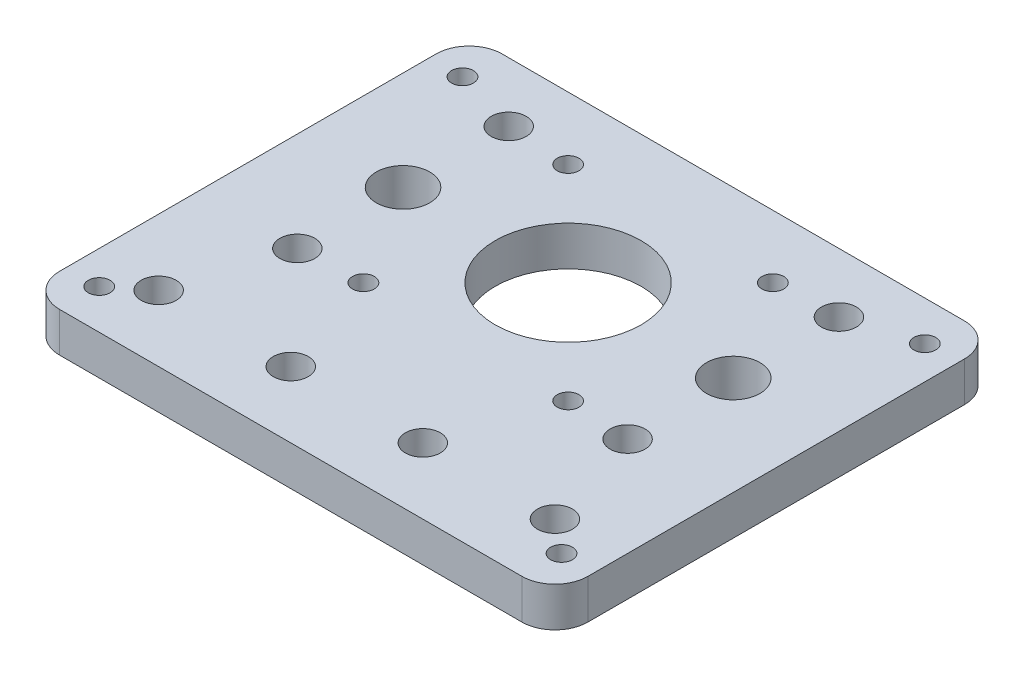
from build123d import *

# Parameters (mm, degrees)
SKETCH_1_R      = 11.05
SKETCH_1_R_2    = 1.65
SKETCH_1_R_3    = 4.05
SKETCH_1_R_4    = 2.65
EXTRUDE_1_DEPTH = 6


with BuildPart() as part:
    # 草图1 → 凸台-拉伸1 (new body)
    with BuildSketch(Plane(origin=(0, 0, 0), x_dir=(1, 0, 0), z_dir=(0, 1, 0))):
        with BuildLine():
            Line((-35, -42), (35, -42))
            ThreePointArc((35, -42), (38.535533906, -40.535533906), (40, -37))
            Line((40, -37), (40, 20))
            ThreePointArc((40, 20), (38.535533906, 23.535533906), (35, 25))
            Line((35, 25), (-35, 25))
            ThreePointArc((-35, 25), (-38.535533906, 23.535533906), (-40, 20))
            Line((-40, 20), (-40, -37))
            ThreePointArc((-40, -37), (-38.535533906, -40.535533906), (-35, -42))
        make_face()
        with Locations(Location((0, 0, 0), (0, 0, 270))):
            Circle(SKETCH_1_R, mode=Mode.SUBTRACT)
        with Locations(Location((-15.5, 15.5, 0), (0, 0, 270))):
            Circle(SKETCH_1_R_2, mode=Mode.SUBTRACT)
        with Locations(Location((15.5, 15.5, 0), (0, 0, 270))):
            Circle(SKETCH_1_R_2, mode=Mode.SUBTRACT)
        with Locations(Location((15.5, -15.5, 0), (0, 0, 270))):
            Circle(SKETCH_1_R_2, mode=Mode.SUBTRACT)
        with Locations(Location((-15.5, -15.5, 0), (0, 0, 270))):
            Circle(SKETCH_1_R_2, mode=Mode.SUBTRACT)
        with Locations(Location((-25, 0, 0), (0, 0, 270))):
            Circle(SKETCH_1_R_3, mode=Mode.SUBTRACT)
        with Locations(Location((-25, 16, 0), (0, 0, 270))):
            Circle(SKETCH_1_R_4, mode=Mode.SUBTRACT)
        with Locations(Location((-25, -16, 0), (0, 0, 90))):
            Circle(SKETCH_1_R_4, mode=Mode.SUBTRACT)
        with Locations(Location((25, 0, 0), (0, 0, 90))):
            Circle(SKETCH_1_R_3, mode=Mode.SUBTRACT)
        with Locations(Location((25, -16, 0), (0, 0, 270))):
            Circle(SKETCH_1_R_4, mode=Mode.SUBTRACT)
        with Locations(Location((25, 16, 0), (0, 0, 90))):
            Circle(SKETCH_1_R_4, mode=Mode.SUBTRACT)
        with Locations(Location((-35, 19, 0), (0, 0, 270))):
            Circle(SKETCH_1_R_2, mode=Mode.SUBTRACT)
        with Locations(Location((-35, -36, 0), (0, 0, 270))):
            Circle(SKETCH_1_R_2, mode=Mode.SUBTRACT)
        with Locations(Location((35, -36, 0), (0, 0, 90))):
            Circle(SKETCH_1_R_2, mode=Mode.SUBTRACT)
        with Locations(Location((35, 19, 0), (0, 0, 90))):
            Circle(SKETCH_1_R_2, mode=Mode.SUBTRACT)
        with Locations(Location((-10, -32, 0), (0, 0, 270))):
            Circle(SKETCH_1_R_4, mode=Mode.SUBTRACT)
        with Locations(Location((-30, -32, 0), (0, 0, 270))):
            Circle(SKETCH_1_R_4, mode=Mode.SUBTRACT)
        with Locations(Location((30, -32, 0), (0, 0, 90))):
            Circle(SKETCH_1_R_4, mode=Mode.SUBTRACT)
        with Locations(Location((10, -32, 0), (0, 0, 90))):
            Circle(SKETCH_1_R_4, mode=Mode.SUBTRACT)
    extrude(amount=EXTRUDE_1_DEPTH)


solid = part.part
